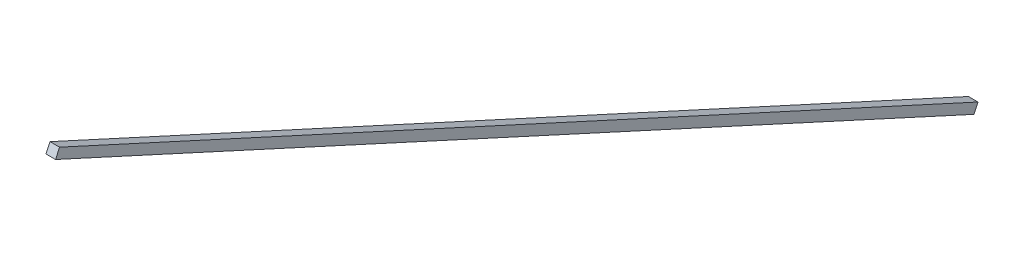
from build123d import *

# Parameters (mm, degrees)
SKETCH1_W           = 2
SKETCH1_H           = 2
BOSS_EXTRUDE1_DEPTH = 211


with BuildPart() as part:
    # Sketch1 → Boss-Extrude1 (new body)
    with BuildSketch(Plane(origin=(0.00245906, -3.767454065, -8.239121433), x_dir=(0.9999999614154527, 5.9114249102810174e-05, 0.00027143065211480505), z_dir=(-0.00027143065211480494, 0.41585091067480767, 0.9094327608000133))):
        with Locations((22.658984814, -65.968896776)):
            Rectangle(SKETCH1_W, SKETCH1_H)
    extrude(amount=BOSS_EXTRUDE1_DEPTH)


solid = part.part
